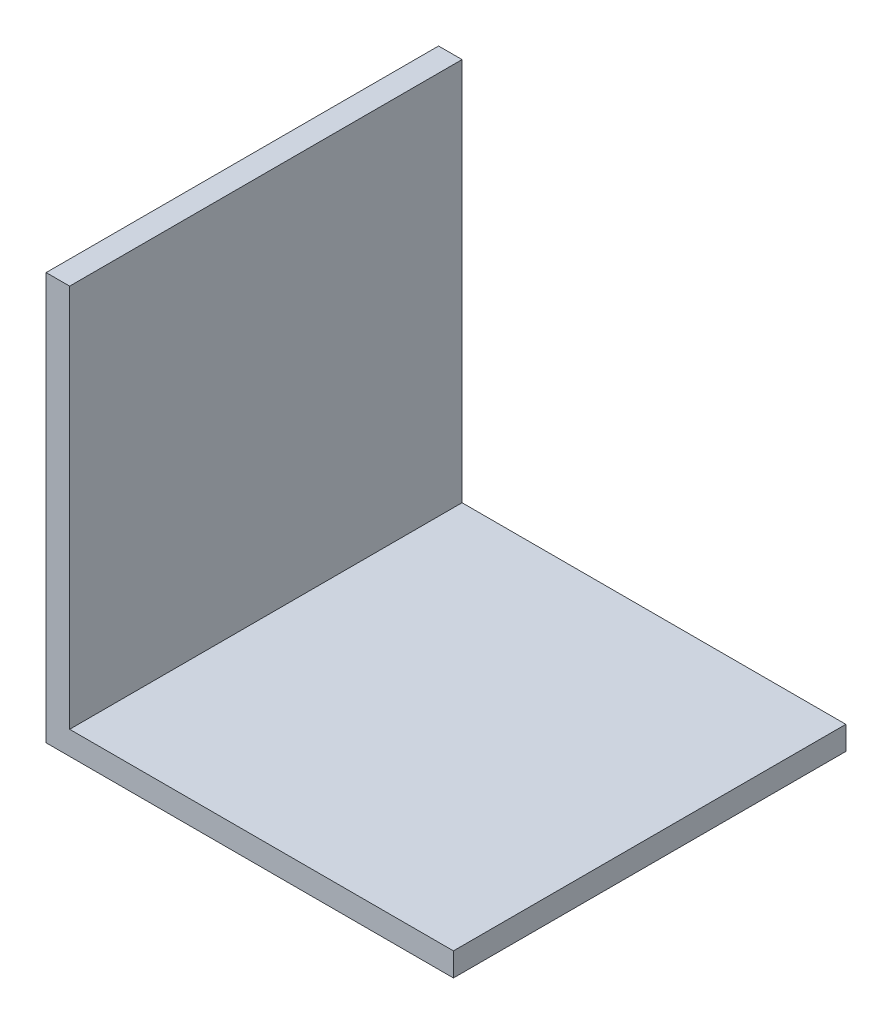
from build123d import *

# Parameters (mm, degrees)
BOSS_EXTRUDE1_DEPTH = 25.05


with BuildPart() as part:
    # Sketch1 → Boss-Extrude1 (new, symmetric)
    with BuildSketch(Plane.XY):
        Polygon((0, 0), (0, 52), (3, 52), (3, 3), (52, 3), (52, 0), align=None)
    boss_extrude1 = extrude(amount=BOSS_EXTRUDE1_DEPTH, both=True)


with BuildPart() as mirror1_1:
    # Mirror1: Boss-Extrude1 across plane
    add(boss_extrude1.mirror(Plane.XY))


with BuildPart() as part_1:
    add(part.part)

    # Mirror1 united with what the copies touc: union Mirror1_1
    add(mirror1_1.part)


solid = part_1.part
